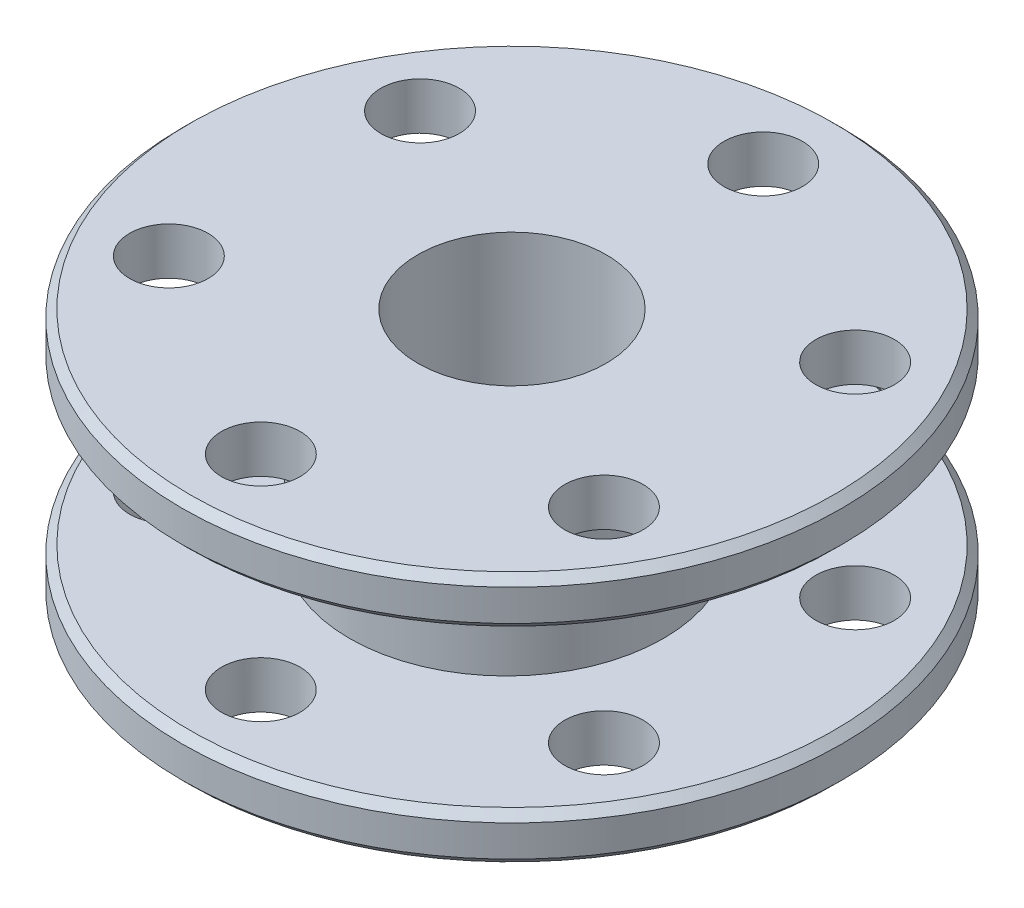
from build123d import *

# Parameters (mm, degrees)
SKETCH1_R           = 21
SKETCH1_R_2         = 6
SKETCH1_R_3         = 2.5
BOSS_EXTRUDE1_DEPTH = 16
SKETCH2_W           = 18.103008707
SKETCH2_H           = 10
CHAMFER1_SIZE       = 0.5


with BuildPart() as part:
    # Sketch1 → Boss-Extrude1 (new body)
    with BuildSketch(Plane(origin=(0, 0, 0), x_dir=(1, 0, 0), z_dir=(0, 1, 0))):
        with Locations(Location((0, 0, 0), (0, 0, 270))):
            Circle(SKETCH1_R)
        with Locations(Location((0, 0, 0), (0, 0, 270))):
            Circle(SKETCH1_R_2, mode=Mode.SUBTRACT)
        with Locations(Location((0, 16, 0), (0, 0, 270))):
            Circle(SKETCH1_R_3, mode=Mode.SUBTRACT)
        with Locations(Location((13.856406461, 8, 0), (0, 0, 270))):
            Circle(SKETCH1_R_3, mode=Mode.SUBTRACT)
        with Locations(Location((13.856406461, -8, 0), (0, 0, 270))):
            Circle(SKETCH1_R_3, mode=Mode.SUBTRACT)
        with Locations(Location((0, -16, 0), (0, 0, 270))):
            Circle(SKETCH1_R_3, mode=Mode.SUBTRACT)
        with Locations(Location((-13.856406461, -8, 0), (0, 0, 270))):
            Circle(SKETCH1_R_3, mode=Mode.SUBTRACT)
        with Locations(Location((-13.856406461, 8, 0), (0, 0, 270))):
            Circle(SKETCH1_R_3, mode=Mode.SUBTRACT)
    extrude(amount=BOSS_EXTRUDE1_DEPTH)

    # Sketch2 → Cut-Revolve1 (revolve, cut)
    with BuildSketch(Plane(origin=(0, 0, 0), x_dir=(0, 0, -1), z_dir=(1, 0, 0))):
        with Locations((18.702543153, 8)):
            Rectangle(SKETCH2_W, SKETCH2_H)
    revolve(axis=Axis((0, 0, 0.348961201), (0, 1, 0)), mode=Mode.SUBTRACT)

    # Chamfer1
    chamfer1_edges = [part.edges().sort_by_distance(p)[0] for p in [
        (0, 0, -21),
        (0, 3, -21),
        (0, 13, -21),
        (0, 16, -21),
    ]]
    chamfer(chamfer1_edges, length=CHAMFER1_SIZE)


solid = part.part
